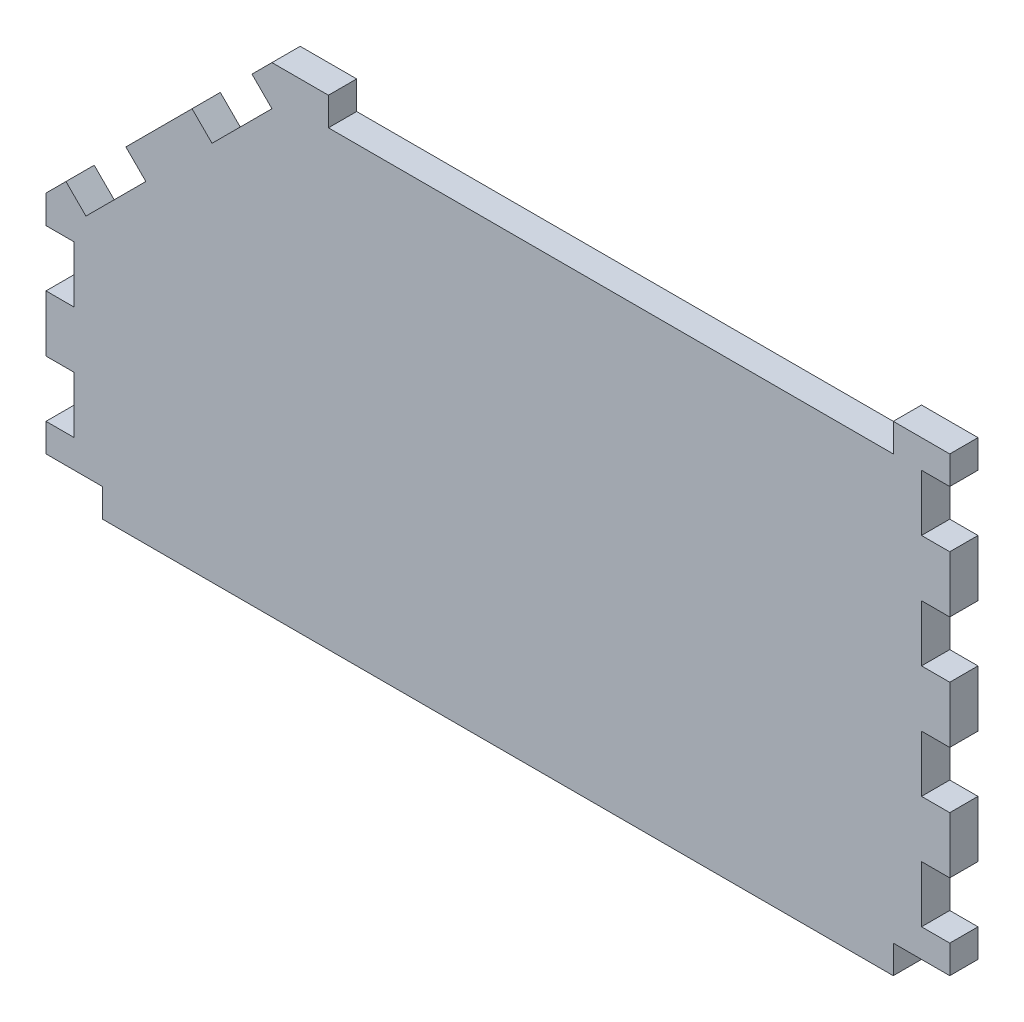
from build123d import *

# Parameters (mm, degrees)
BOSS_EXTRU_1_DEPTH      = 5
ESQUISSE2_W             = 5
ESQUISSE2_H             = 10
ENL_V_MAT_EXTRU_1_DEPTH = 10
ENL_V_MAT_EXTRU_2_DEPTH = 10


with BuildPart() as part:
    # Esquisse1 → Boss.-Extru.1 (new body)
    with BuildSketch(Plane.XY):
        Polygon((-80, 0), (-40, 40), (-30, 40), (-30, 35), (70, 35), (70, 40), (80, 40), (80, -40), (70, -40), (70, -45), (-70, -45), (-70, -40), (-80, -40), (-80, -35), (-75, -35), (-75, -25), (-80, -25), (-80, -15), (-75, -15), (-75, -5), (-80, -5), align=None)
    extrude(amount=BOSS_EXTRU_1_DEPTH)

    # Esquisse2 → Enlèv. mat.-Extru.1 (cut)
    with BuildSketch(Plane.XY.offset(5)):
        with Locations((77.5, -30)):
            Rectangle(ESQUISSE2_W, ESQUISSE2_H)
        with Locations((77.5, -10)):
            Rectangle(ESQUISSE2_W, ESQUISSE2_H)
        with Locations((77.5, 10)):
            Rectangle(ESQUISSE2_W, ESQUISSE2_H)
        with Locations((77.5, 30)):
            Rectangle(ESQUISSE2_W, ESQUISSE2_H)
    extrude(amount=-ENL_V_MAT_EXTRU_1_DEPTH, mode=Mode.SUBTRACT)

    # Esquisse3 → Enlèv. mat.-Extru.2 (cut)
    with BuildSketch(Plane.XY.offset(5)):
        Polygon((-43.535533906, 36.464466094), (-54.142135624, 25.857864376), (-50.606601718, 22.32233047), (-40, 32.928932188), align=None)
        Polygon((-65.857864376, 14.142135624), (-76.464466094, 3.535533906), (-72.928932188, 0), (-62.32233047, 10.606601718), align=None)
    extrude(amount=-ENL_V_MAT_EXTRU_2_DEPTH, mode=Mode.SUBTRACT)


solid = part.part
